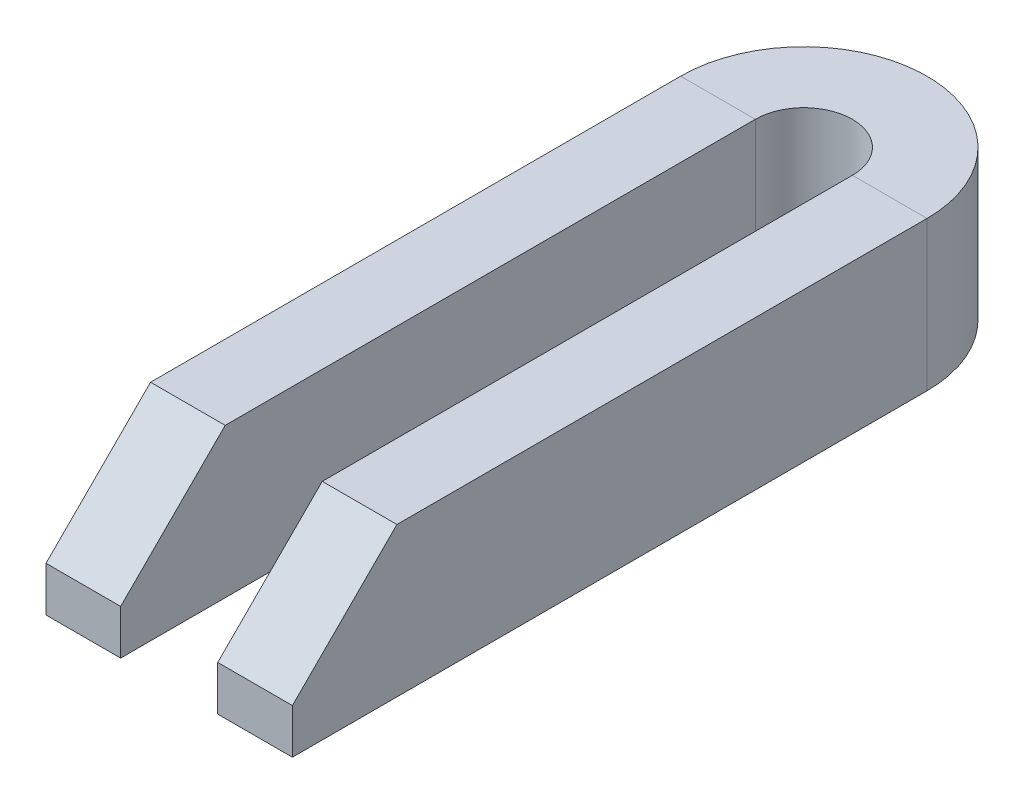
from build123d import *

# Parameters (mm, degrees)
SKETCH1_W     = 20
SKETCH1_H     = 40
CHAMFER1_SIZE = 28


with BuildPart() as part:
    # Sweep1: sweep along a path in Sketch2
    with BuildLine(Plane(origin=(0, 0, 0), x_dir=(1, 0, 0), z_dir=(0, 1, 0))) as sweep1_path:
        Line((-13, 0), (-13, 170))
        ThreePointArc((-13, 170), (0, 183), (13, 170))
        Line((13, 170), (13, 0))
    # Sketch1 → Sweep1 (sweep)
    with BuildSketch(Plane.XY):
        with Locations((-23, 20)):
            Rectangle(SKETCH1_W, SKETCH1_H)
    sweep(path=sweep1_path.line)

    # Chamfer1
    chamfer1_edges = [part.edges().sort_by_distance(p)[0] for p in [
        (-23, 40, 0),
        (23, 40, 0),
    ]]
    chamfer(chamfer1_edges, length=CHAMFER1_SIZE)


solid = part.part
